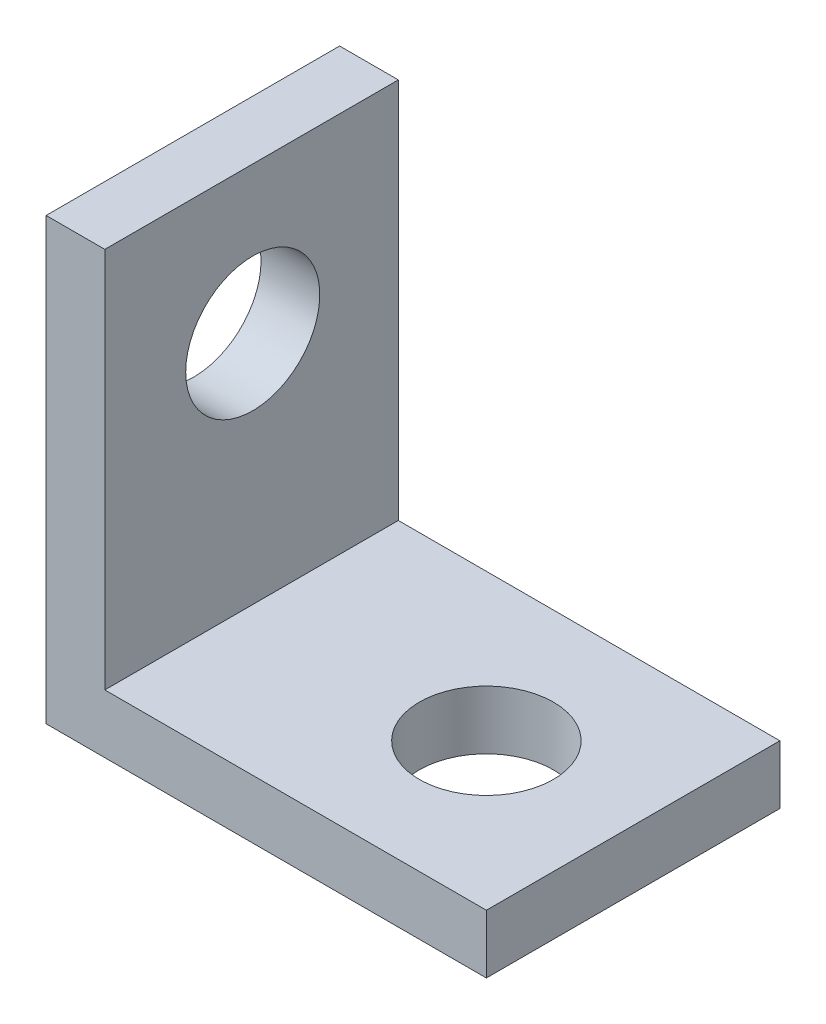
from build123d import *

# Parameters (mm, degrees)
BOSS_EXTRUDE1_DEPTH = 12.7
SKETCH2_R           = 2.9
CUT_EXTRUDE1_DEPTH  = 12.7
SKETCH3_R           = 2.9
CUT_EXTRUDE3_DEPTH  = 12.7


with BuildPart() as part:
    # Sketch1 → Boss-Extrude1 (new body)
    with BuildSketch(Plane.XY):
        Polygon((0, 0), (0, 19.05), (2.54, 19.05), (2.54, 2.54), (19.05, 2.54), (19.05, 0), align=None)
    extrude(amount=BOSS_EXTRUDE1_DEPTH)

    # Sketch2 → Cut-Extrude1 (cut)
    with BuildSketch(Plane(origin=(0, 0, 0), x_dir=(0, 0, -1), z_dir=(1, 0, 0))):
        with Locations(Location((-6.299909987, 12.7, 0), (0, 0, 180))):
            Circle(SKETCH2_R)
    extrude(amount=CUT_EXTRUDE1_DEPTH, mode=Mode.SUBTRACT)

    # Sketch3 → Cut-Extrude3 (cut)
    with BuildSketch(Plane(origin=(0, 0, 0), x_dir=(1, 0, 0), z_dir=(0, 1, 0))):
        with Locations(Location((12.7, -6.35, 0), (0, 0, 90))):
            Circle(SKETCH3_R)
    extrude(amount=CUT_EXTRUDE3_DEPTH, mode=Mode.SUBTRACT)


solid = part.part
